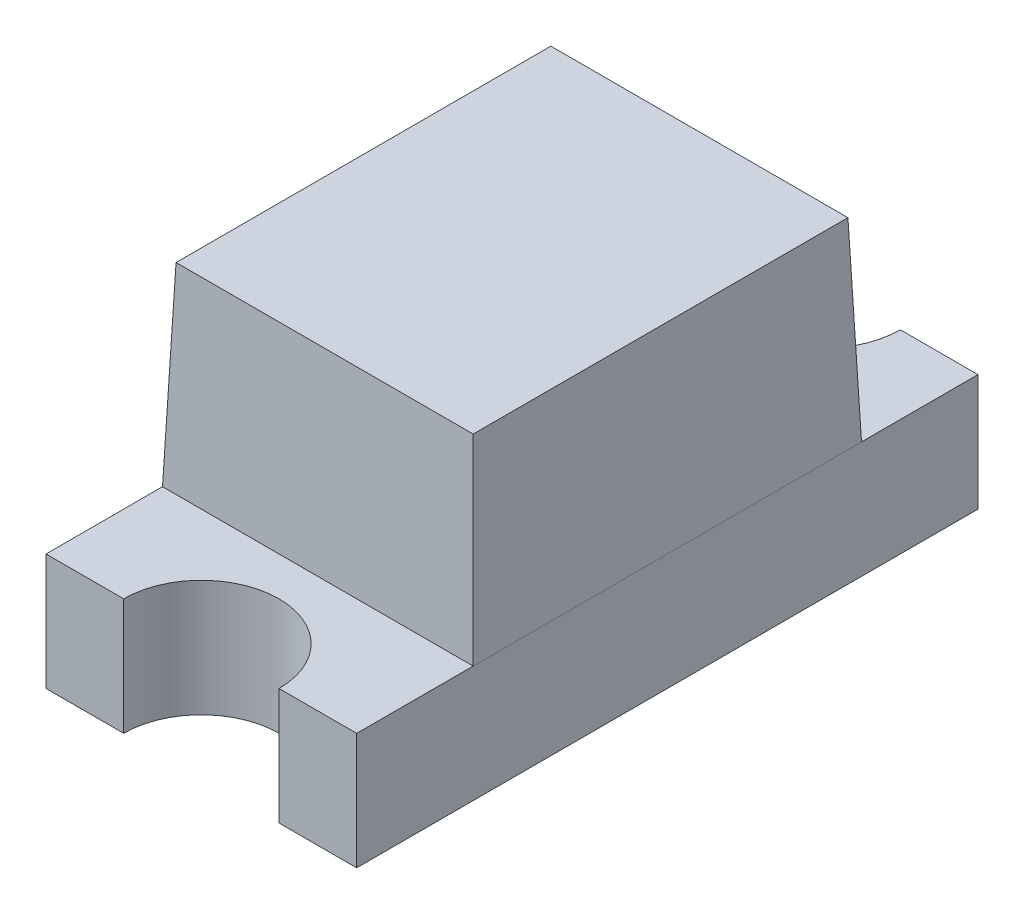
from build123d import *

# Parameters (mm, degrees)
ESTRUSIONE_ESTRUSIONE1_DEPTH = 0.3
SCHIZZO2_R                   = 0.05
TAGLIO_ESTRUSIONE1_DEPTH     = 0.05
SCHIZZO3_W                   = 0.8
SCHIZZO3_H                   = 1
ESTRUSIONE_ESTRUSIONE2_DEPTH = 0.5
ESTRUSIONE_ESTRUSIONE2_TAPER = 2


with BuildPart() as part:
    # Schizzo1 → Estrusione-Estrusione1 (new body)
    with BuildSketch(Plane(origin=(0, 0, 0), x_dir=(1, 0, 0), z_dir=(0, 1, 0))):
        with BuildLine():
            Line((0.8, 1.6), (0.6, 1.6))
            ThreePointArc((0.6, 1.6), (0.4, 1.4), (0.2, 1.6))
            Line((0.2, 1.6), (0, 1.6))
            Line((0, 1.6), (0, 0))
            Line((0, 0), (0.2, 0))
            ThreePointArc((0.2, 0), (0.4, 0.2), (0.6, 0))
            Line((0.6, 0), (0.8, 0))
            Line((0.8, 0), (0.8, 1.6))
        make_face()
    extrude(amount=ESTRUSIONE_ESTRUSIONE1_DEPTH)

    # Schizzo2 → Taglio-Estrusione1 (cut)
    with BuildSketch(Plane(origin=(0, 0.3, 0), x_dir=(1, 0, 0), z_dir=(0, 1, 0))):
        with Locations(Location((0.092481548, 1.382737711, 0), (0, 0, 270))):
            Circle(SCHIZZO2_R)
    extrude(amount=-TAGLIO_ESTRUSIONE1_DEPTH, mode=Mode.SUBTRACT)

    # Schizzo3 → Estrusione-Estrusione2 (add)
    with BuildSketch(Plane(origin=(0, 0.3, 0), x_dir=(1, 0, 0), z_dir=(0, 1, 0))):
        with Locations((0.4, 0.8)):
            Rectangle(SCHIZZO3_W, SCHIZZO3_H)
    extrude(amount=ESTRUSIONE_ESTRUSIONE2_DEPTH, taper=ESTRUSIONE_ESTRUSIONE2_TAPER)


solid = part.part
